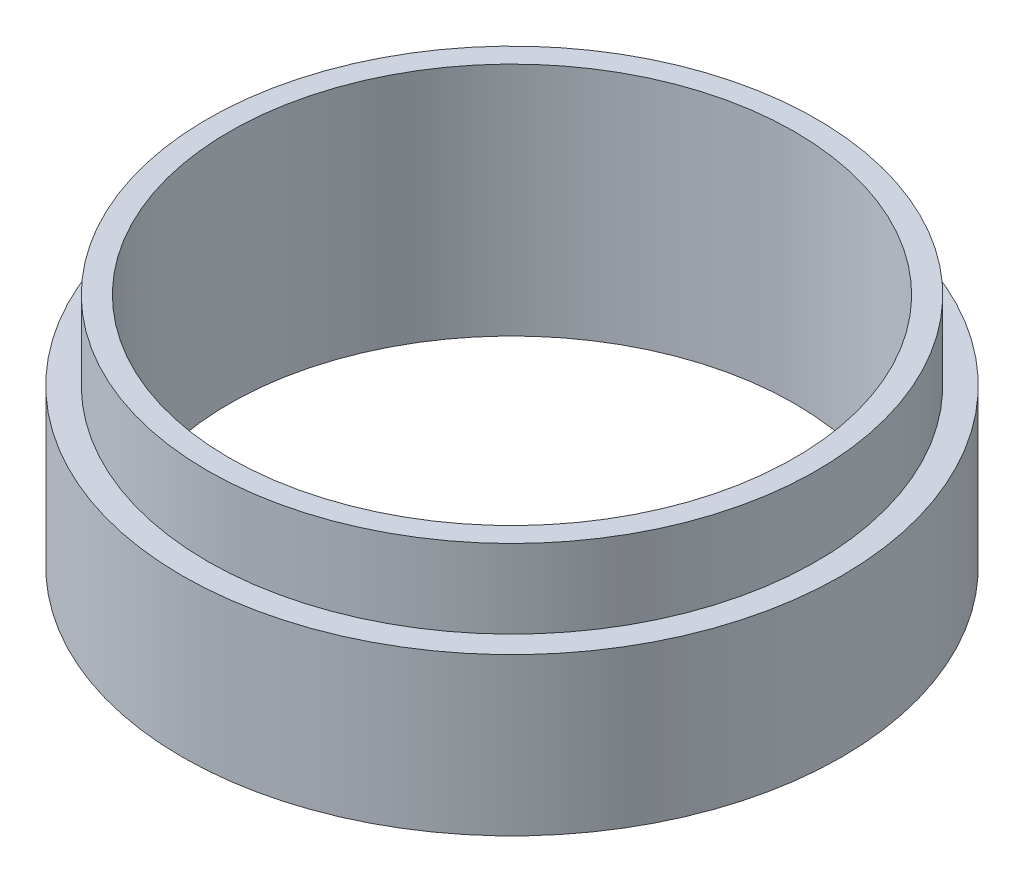
from build123d import *

# Parameters (mm, degrees)
SKETCH1_W           = 21
SKETCH1_H           = 10
SKETCH2_R           = 18
CUT_EXTRUDE1_DEPTH  = 32.336879232
SKETCH4_R           = 19.4
BOSS_EXTRUDE1_DEPTH = 5
SKETCH5_R           = 18
CUT_EXTRUDE2_DEPTH  = 34.271609519


with BuildPart() as part:
    # Sketch1 → Revolve1 (revolve)
    with BuildSketch(Plane.XY, mode=Mode.PRIVATE) as revolve1_sk:
        with Locations((10.5, 5)):
            Rectangle(SKETCH1_W, SKETCH1_H)
    revolve(revolve1_sk.sketch.rotate(Axis((0, 0, 0), (0, 1, 0)), 90), axis=Axis((0, 0, 0), (0, 1, 0)))

    # Sketch2 → Cut-Extrude1 (cut, through all)
    with BuildSketch(Plane(origin=(0, 10, 0), x_dir=(1, 0, 0), z_dir=(0, 1, 0))):
        with Locations(Location((0, 0, 0), (0, 0, 270))):
            Circle(SKETCH2_R)
    extrude(amount=-CUT_EXTRUDE1_DEPTH, mode=Mode.SUBTRACT)

    # Sketch4 → Boss-Extrude1 (add)
    with BuildSketch(Plane(origin=(0, 10, 0), x_dir=(1, 0, 0), z_dir=(0, 1, 0))):
        with Locations(Location((0, 0, 0), (0, 0, 270))):
            Circle(SKETCH4_R)
    extrude(amount=BOSS_EXTRUDE1_DEPTH)

    # Sketch5 → Cut-Extrude2 (cut, through all)
    with BuildSketch(Plane(origin=(0, 15, 0), x_dir=(1, 0, 0), z_dir=(0, 1, 0))):
        with Locations(Location((0, 0, 0), (0, 0, 270))):
            Circle(SKETCH5_R)
    extrude(amount=-CUT_EXTRUDE2_DEPTH, mode=Mode.SUBTRACT)


solid = part.part
